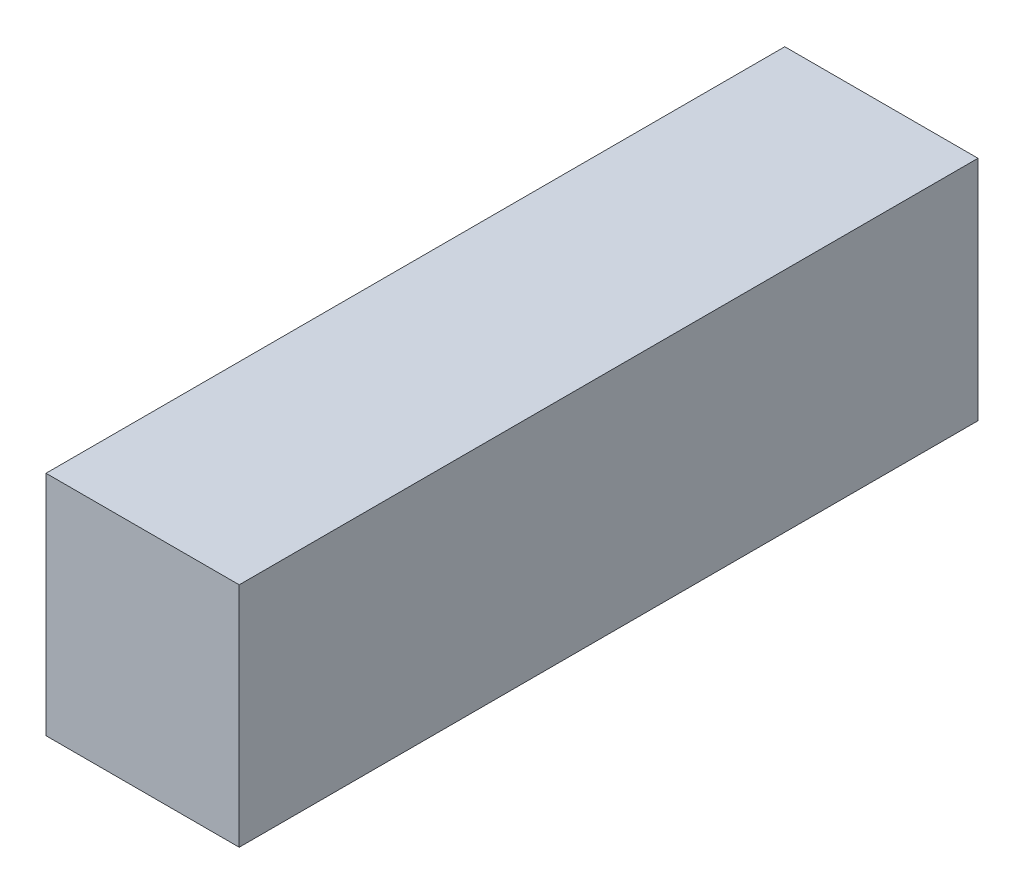
from build123d import *

# Parameters (mm, degrees)
SKETCH1_W           = 17
SKETCH1_H           = 20
BOSS_EXTRUDE1_DEPTH = 32.5


with BuildPart() as part:
    # Sketch1 → Boss-Extrude1 (new, symmetric)
    with BuildSketch(Plane.XY):
        Rectangle(SKETCH1_W, SKETCH1_H)
    extrude(amount=BOSS_EXTRUDE1_DEPTH, both=True)


solid = part.part
